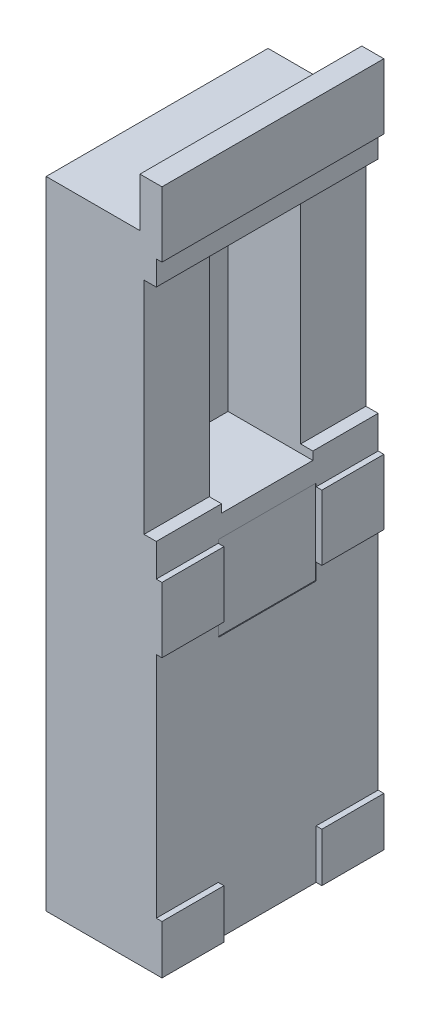
from build123d import *

# Parameters (mm, degrees)
GUIDE_AND_SOLID_STOPS_DEPTH   = 13.6
SKETCH_3_W                    = 8.4
SKETCH_3_H                    = 14
NUT_TONGUE_CHANNEL_DEPTH      = 2.8
SKETCH_4_W                    = 6.25
SKETCH_4_H                    = 5.2
LOWER_YOKE_RELIEF_DEPTH       = 3
SKETCH_5_W                    = 3.7
SKETCH_5_H                    = 3
LOWER_INWARD_STOP_DEPTH       = 3.8
SKETCH_7_W                    = 3.7
SKETCH_7_H                    = 3
EXTRUDE_2_DEPTH               = 3.8
REMOVE_LOWER_TAIL_DEPTH       = 62.002151601
REMOVE_LOWER_TAIL_DEPTH_BACK  = 62.002151601
SKETCH_8_W                    = 17
SKETCH_8_H                    = 17
WIDER_SHAFT_RELIEF_DEPTH      = 62.002151601
WIDER_SHAFT_RELIEF_DEPTH_BACK = 62.002151601
SKETCH_9_W                    = 9.85
SKETCH_9_H                    = 46


with BuildPart() as part:
    # 草图1 → Guide_and_solid_stops (new body)
    with BuildSketch(Plane.XY):
        Polygon((-10.2, 0), (-16.95, 0), (-16.95, 54), (-11.2, 54), (-11.2, 57), (-4.7, 57), (-4.7, 53), (-10.2, 53), (-10.2, 51.5), (-10.95, 51.5), (-10.95, 38), (-10.2, 38), (-10.2, 36), (-4.7, 36), (-4.7, 32), (-10.2, 32), align=None)
    extrude(amount=GUIDE_AND_SOLID_STOPS_DEPTH)

    # 草图3 → Nut_tongue_channel (cut, symmetric)
    with BuildSketch(Plane.XY.offset(6.8)):
        with Locations((-11.2, 44.5)):
            Rectangle(SKETCH_3_W, SKETCH_3_H)
    extrude(amount=NUT_TONGUE_CHANNEL_DEPTH, both=True, mode=Mode.SUBTRACT)

    # 草图4 → Lower_yoke_relief (cut, symmetric)
    with BuildSketch(Plane.XY.offset(6.8)):
        with Locations((-7.125, 33.6)):
            Rectangle(SKETCH_4_W, SKETCH_4_H)
    extrude(amount=LOWER_YOKE_RELIEF_DEPTH, both=True, mode=Mode.SUBTRACT)

    # 草图5 → Lower_inward_stop (add)
    with BuildSketch(Plane.XY):
        with Locations((-9.35, 16.5)):
            Rectangle(SKETCH_5_W, SKETCH_5_H)
    extrude(amount=LOWER_INWARD_STOP_DEPTH)

    # 草图7 → 凸台-拉伸2 (add)
    with BuildSketch(Plane.XY.offset(9.8)):
        with Locations((-9.35, 16.5)):
            Rectangle(SKETCH_7_W, SKETCH_7_H)
    extrude(amount=EXTRUDE_2_DEPTH)

    # 草图8 → Remove_lower_tail (cut, two sides: drawn at the far end of the back side and taken through both)
    with BuildSketch(Plane.XY.offset(-REMOVE_LOWER_TAIL_DEPTH_BACK)):
        with Locations((-11.5, 6.5)):
            Rectangle(SKETCH_8_W, SKETCH_8_H)
    extrude(amount=REMOVE_LOWER_TAIL_DEPTH + REMOVE_LOWER_TAIL_DEPTH_BACK, mode=Mode.SUBTRACT)

    # 草图9 → Wider_shaft_relief (cut, two sides: drawn at the far end of the back side and taken through both)
    with BuildSketch(Plane.XY.offset(-WIDER_SHAFT_RELIEF_DEPTH_BACK)):
        with Locations((-4.925, 36)):
            Rectangle(SKETCH_9_W, SKETCH_9_H)
    extrude(amount=WIDER_SHAFT_RELIEF_DEPTH + WIDER_SHAFT_RELIEF_DEPTH_BACK, mode=Mode.SUBTRACT)


solid = part.part
